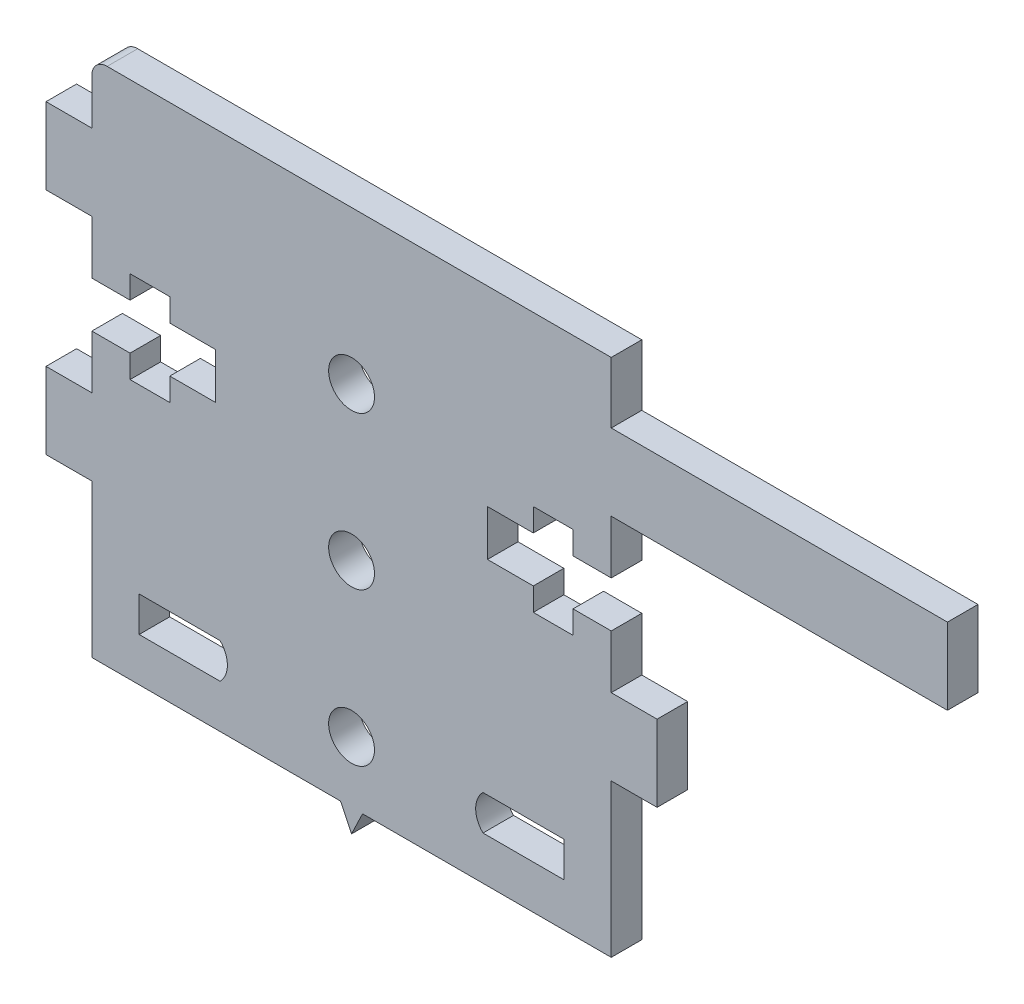
from build123d import *

# Parameters (mm, degrees)
SKETCH_1_R      = 1.5
EXTRUDE_1_DEPTH = 2


with BuildPart() as part:
    # 草图1 → 凸台-拉伸1 (new body)
    with BuildSketch(Plane.XY):
        with BuildLine():
            Line((16.993865071, 16), (16.993865071, 20))
            Line((16.993865071, 20), (-15.993865071, 20))
            ThreePointArc((-15.993865071, 20), (-16.700971852, 19.707106781), (-16.993865071, 19))
            Line((-16.993865071, 19), (-16.993865071, 16))
            Line((-16.993865071, 16), (-19.993865071, 16))
            Line((-19.993865071, 16), (-19.993865071, 11))
            Line((-19.993865071, 11), (-16.993865071, 11))
            Line((-16.993865071, 11), (-16.993865071, 7.5))
            Line((-16.993865071, 7.5), (-14.493865071, 7.5))
            Line((-14.493865071, 7.5), (-14.493865071, 9))
            Line((-14.493865071, 9), (-11.893865071, 9))
            Line((-11.893865071, 9), (-11.893865071, 7.5))
            Line((-11.893865071, 7.5), (-8.893865071, 7.5))
            Line((-8.893865071, 7.5), (-8.893865071, 4.5))
            Line((-8.893865071, 4.5), (-11.893865071, 4.5))
            Line((-11.893865071, 4.5), (-11.893865071, 3))
            Line((-11.893865071, 3), (-14.493865071, 3))
            Line((-14.493865071, 3), (-14.493865071, 4.5))
            Line((-14.493865071, 4.5), (-16.993865071, 4.5))
            Line((-16.993865071, 4.5), (-16.993865071, 1))
            Line((-16.993865071, 1), (-19.993865071, 1))
            Line((-19.993865071, 1), (-19.993865071, -4))
            Line((-19.993865071, -4), (-16.993865071, -4))
            Line((-16.993865071, -4), (-16.993865071, -13))
            Line((-16.993865071, -13), (-16.993865071, -14))
            Line((-16.993865071, -14), (-0.721190694, -14))
            Line((-0.721190694, -14), (0, -15.5))
            Line((0, -15.5), (0.721190694, -14))
            Line((0.721190694, -14), (16.993865071, -14))
            Line((16.993865071, -14), (16.993865071, -13))
            Line((16.993865071, -13), (16.993865071, -4))
            Line((16.993865071, -4), (19.993865071, -4))
            Line((19.993865071, -4), (19.993865071, 1))
            Line((19.993865071, 1), (16.993865071, 1))
            Line((16.993865071, 1), (16.993865071, 4.5))
            Line((16.993865071, 4.5), (14.493865071, 4.5))
            Line((14.493865071, 4.5), (14.493865071, 3))
            Line((14.493865071, 3), (11.893865071, 3))
            Line((11.893865071, 3), (11.893865071, 4.5))
            Line((11.893865071, 4.5), (8.893865071, 4.5))
            Line((8.893865071, 4.5), (8.893865071, 7.5))
            Line((8.893865071, 7.5), (11.893865071, 7.5))
            Line((11.893865071, 7.5), (11.893865071, 9))
            Line((11.893865071, 9), (14.493865071, 9))
            Line((14.493865071, 9), (14.493865071, 7.5))
            Line((14.493865071, 7.5), (16.993865071, 7.5))
            Line((16.993865071, 7.5), (16.993865071, 11))
            Line((16.993865071, 11), (38.993865071, 11))
            Line((38.993865071, 11), (38.993865071, 16))
            Line((38.993865071, 16), (16.993865071, 16))
        make_face()
        with Locations((0, -10)):
            Circle(SKETCH_1_R, mode=Mode.SUBTRACT)
        Circle(SKETCH_1_R, mode=Mode.SUBTRACT)
        with Locations((0, 10)):
            Circle(SKETCH_1_R, mode=Mode.SUBTRACT)
        with BuildLine():
            Line((13.9, -11.15), (8.6, -11.15))
            ThreePointArc((8.6, -11.15), (8.123654403, -10), (8.6, -8.85))
            Line((8.6, -8.85), (13.9, -8.85))
            Line((13.9, -8.85), (13.9, -11.15))
        make_face(mode=Mode.SUBTRACT)
        with BuildLine():
            Line((-13.9, -8.85), (-8.6, -8.85))
            ThreePointArc((-8.6, -8.85), (-8.123654403, -10), (-8.6, -11.15))
            Line((-8.6, -11.15), (-13.9, -11.15))
            Line((-13.9, -11.15), (-13.9, -8.85))
        make_face(mode=Mode.SUBTRACT)
    extrude(amount=EXTRUDE_1_DEPTH)


solid = part.part
